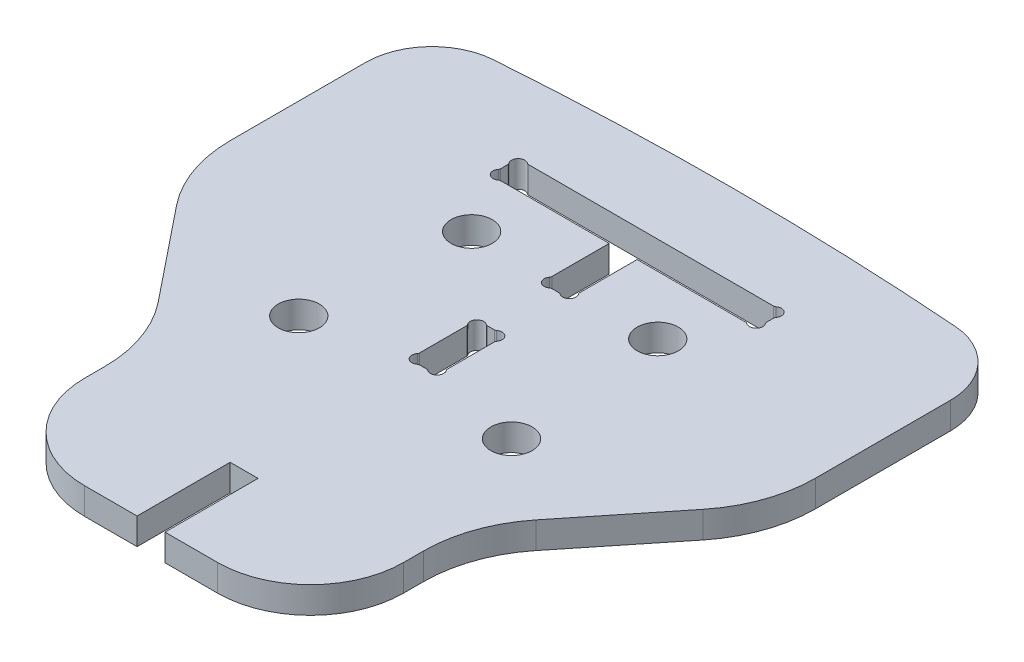
from build123d import *

# Parameters (mm, degrees)
EXTRUDE_1_DEPTH     = 2
SKETCH_2_W          = 1.05
SKETCH_2_H          = 5.1
CUT_EXTRUDE_1_DEPTH = 343.513123836
CUT_EXTRUDE_2_DEPTH = 343.513123836
FILLET_1_R          = 0.2
SKETCH_4_R          = 1.55
CUT_EXTRUDE_3_DEPTH = 343.513123836
FILLET_2_R          = 5
EXTRUDE_START       = -2
EXTRUDE_2_DEPTH     = 2
CUT_EXTRUDE_START   = -10
CUT_EXTRUDE_5_DEPTH = 10
SKETCH_6_W          = 2.1
SKETCH_6_H          = 7
CUT_EXTRUDE_4_DEPTH = 2
FILLET_8_R          = 7
FILLET_5_R          = 10
FILLET_6_R          = 10


with BuildPart() as part:
    # 草图1 → 凸台-拉伸1 (new body)
    with BuildSketch(Plane(origin=(0, 0, 0), x_dir=(1, 0, 0), z_dir=(0, 1, 0))):
        with BuildLine():
            Line((-22, 322.5), (-17, 320.227272727))
            Line((-17, 320.227272727), (-17, 312.037257391))
            ThreePointArc((-17, 312.037257391), (0, 312.5), (17, 312.037257391))
            Line((17, 312.037257391), (17, 320.227272727))
            Line((17, 320.227272727), (22, 322.5))
            Line((22, 322.5), (22, 340.767946523))
            ThreePointArc((22, 340.767946523), (0, 341.8), (-22, 340.767946523))
            Line((-22, 340.767946523), (-22, 322.5))
        make_face()
    extrude(amount=EXTRUDE_1_DEPTH)

    # 草图2 → 切除-拉伸1 (cut, through all)
    with BuildSketch(Plane(origin=(0, 2, 0), x_dir=(1, 0, 0), z_dir=(0, 1, 0))):
        Polygon((0, 335.65), (0, 328.45), (1.05, 328.45), (1.05, 333.55), (10, 333.55), (10, 335.65), align=None)
        Polygon((-1.05, 328.45), (0, 328.45), (0, 335.65), (-10, 335.65), (-10, 333.55), (-1.05, 333.55), align=None)
        with Locations((0.525, 321.05)):
            Rectangle(SKETCH_2_W, SKETCH_2_H)
        with Locations((-0.525, 321.05)):
            Rectangle(SKETCH_2_W, SKETCH_2_H)
    extrude(amount=-CUT_EXTRUDE_1_DEPTH, mode=Mode.SUBTRACT)

    # 草图3 → 切除-拉伸2 (cut, through all)
    with BuildSketch(Plane(origin=(0, 2, 0), x_dir=(1, 0, 0), z_dir=(0, 1, 0))):
        with BuildLine():
            Line((10, 335.65), (10, 334.942893219))
            ThreePointArc((10, 334.942893219), (10.108386376, 335.105104893), (10.146446609, 335.296446609))
            ThreePointArc((10.146446609, 335.296446609), (10.108386376, 335.487788326), (10, 335.65))
        make_face()
        with BuildLine():
            ThreePointArc((10, 335.65), (9.646446609, 335.796446609), (9.292893219, 335.65))
            Line((9.292893219, 335.65), (10, 335.65))
        make_face()
        with BuildLine():
            ThreePointArc((10.146446609, 333.903553391), (10.108386376, 334.094895107), (10, 334.257106781))
            Line((10, 334.257106781), (10, 333.55))
            ThreePointArc((10, 333.55), (10.108386376, 333.712211674), (10.146446609, 333.903553391))
        make_face()
        with BuildLine():
            Line((10, 333.55), (9.292893219, 333.55))
            ThreePointArc((9.292893219, 333.55), (9.646446609, 333.403553391), (10, 333.55))
        make_face()
        with BuildLine():
            ThreePointArc((1.196446609, 328.803553391), (1.158386376, 328.994895107), (1.05, 329.157106781))
            Line((1.05, 329.157106781), (1.05, 328.45))
            ThreePointArc((1.05, 328.45), (1.158386376, 328.612211674), (1.196446609, 328.803553391))
        make_face()
        with BuildLine():
            Line((1.05, 328.45), (0.342893219, 328.45))
            ThreePointArc((0.342893219, 328.45), (0.696446609, 328.303553391), (1.05, 328.45))
        make_face()
        with BuildLine():
            ThreePointArc((1.196446609, 323.246446609), (1.158386376, 323.437788326), (1.05, 323.6))
            Line((1.05, 323.6), (1.05, 322.892893219))
            ThreePointArc((1.05, 322.892893219), (1.158386376, 323.055104893), (1.196446609, 323.246446609))
        make_face()
        with BuildLine():
            ThreePointArc((1.05, 323.6), (0.696446609, 323.746446609), (0.342893219, 323.6))
            Line((0.342893219, 323.6), (1.05, 323.6))
        make_face()
        with BuildLine():
            ThreePointArc((1.196446609, 318.853553391), (1.158386376, 319.044895107), (1.05, 319.207106781))
            Line((1.05, 319.207106781), (1.05, 318.5))
            ThreePointArc((1.05, 318.5), (1.158386376, 318.662211674), (1.196446609, 318.853553391))
        make_face()
        with BuildLine():
            Line((1.05, 318.5), (0.342893219, 318.5))
            ThreePointArc((0.342893219, 318.5), (0.696446609, 318.353553391), (1.05, 318.5))
        make_face()
    cut_extrude_2 = extrude(amount=-CUT_EXTRUDE_2_DEPTH, mode=Mode.SUBTRACT)

    # 镜向1: 切除-拉伸2 across plane
    add(cut_extrude_2.mirror(Plane(origin=(0, 0, 0), x_dir=(0, 0, 1), z_dir=(1, 0, 0))), mode=Mode.SUBTRACT)

    # 圆角1
    fillet_1_edges = [part.edges().sort_by_distance(p)[0] for p in [
        (1.05, 1, -329.157106781),
        (0.342893219, 1, -323.6),
        (1.05, 1, -319.207106781),
        (9.292893219, 1, -335.65),
        (10, 1, -334.257106781),
        (0.342893219, 1, -328.45),
        (1.05, 1, -322.892893219),
        (0.342893219, 1, -318.5),
        (-10, 1, -334.942893219),
        (-9.292893219, 1, -333.55),
        (-1.05, 1, -329.157106781),
        (-0.342893219, 1, -323.6),
        (-1.05, 1, -319.207106781),
        (-9.292893219, 1, -335.65),
        (-10, 1, -334.257106781),
        (-0.342893219, 1, -328.45),
        (-1.05, 1, -322.892893219),
        (-0.342893219, 1, -318.5),
        (10, 1, -334.942893219),
        (9.292893219, 1, -333.55),
    ]]
    fillet(fillet_1_edges, radius=FILLET_1_R)

    # 草图4 → 切除-拉伸3 (cut, through all)
    with BuildSketch(Plane(origin=(0, 2, 0), x_dir=(1, 0, 0), z_dir=(0, 1, 0))):
        with Locations(Location((7, 329.15, 0), (0, 0, 270))):
            Circle(SKETCH_4_R)
        with Locations(Location((8, 317.15, 0), (0, 0, 270))):
            Circle(SKETCH_4_R)
    cut_extrude_3 = extrude(amount=-CUT_EXTRUDE_3_DEPTH, mode=Mode.SUBTRACT)

    # 镜向2: 切除-拉伸3 across plane
    add(cut_extrude_3.mirror(Plane(origin=(0, 0, 0), x_dir=(0, 0, 1), z_dir=(1, 0, 0))), mode=Mode.SUBTRACT)

    # 圆角2
    fillet_2_edges = [part.edges().sort_by_distance(p)[0] for p in [
        (-22, 1, -340.767946523),
        (22, 1, -340.767946523),
    ]]
    fillet(fillet_2_edges, radius=FILLET_2_R)

    # 草图5 → 凸台-拉伸2 (add)
    with BuildSketch(Plane(origin=(0, 2, 0), x_dir=(1, 0, 0), z_dir=(0, 1, 0)).offset(EXTRUDE_START)):
        with BuildLine():
            Line((-13.733814581, 312.198065877), (-12, 310.037257391))
            Line((-12, 310.037257391), (-12, 298.037257391))
            Line((-12, 298.037257391), (12, 298.037257391))
            Line((12, 298.037257391), (12, 310.037257391))
            Line((12, 310.037257391), (13.733814581, 312.198065877))
            ThreePointArc((13.733814581, 312.198065877), (0, 312.5), (-13.733814581, 312.198065877))
        make_face()
        Polygon((-22, 322.5), (-17, 316.268628695), (-17, 320.227272727), align=None)
        Polygon((17, 316.268628695), (22, 322.5), (17, 320.227272727), align=None)
    extrude(amount=EXTRUDE_2_DEPTH)

    # 草图5<3> → 切除-拉伸5 (cut)
    with BuildSketch(Plane(origin=(0, 2, 0), x_dir=(1, 0, 0), z_dir=(0, 1, 0)).offset(CUT_EXTRUDE_START)):
        with BuildLine():
            Line((-17, 310.037257391), (-17, 312.037257391))
            ThreePointArc((-17, 312.037257391), (-15.367117639, 312.121934019), (-13.733814581, 312.198065877))
            Line((-13.733814581, 312.198065877), (-22, 322.5))
            Line((-22, 322.5), (-22, 310.037257391))
            Line((-22, 310.037257391), (-17, 310.037257391))
        make_face()
        with BuildLine():
            ThreePointArc((-13.733814581, 312.198065877), (-15.367117639, 312.121934019), (-17, 312.037257391))
            Line((-17, 312.037257391), (-17, 310.037257391))
            Line((-17, 310.037257391), (-12, 310.037257391))
            Line((-12, 310.037257391), (-13.733814581, 312.198065877))
        make_face()
        with BuildLine():
            Line((22, 322.5), (13.733814581, 312.198065877))
            ThreePointArc((13.733814581, 312.198065877), (15.367117639, 312.121934019), (17, 312.037257391))
            Line((17, 312.037257391), (17, 310.037257391))
            Line((17, 310.037257391), (22, 310.037257391))
            Line((22, 310.037257391), (22, 322.5))
        make_face()
        with BuildLine():
            Line((13.733814581, 312.198065877), (12, 310.037257391))
            Line((12, 310.037257391), (17, 310.037257391))
            Line((17, 310.037257391), (17, 312.037257391))
            ThreePointArc((17, 312.037257391), (15.367117639, 312.121934019), (13.733814581, 312.198065877))
        make_face()
    extrude(amount=CUT_EXTRUDE_5_DEPTH, mode=Mode.SUBTRACT)

    # 草图6 → 切除-拉伸4 (cut)
    with BuildSketch(Plane(origin=(0, 2, 0), x_dir=(1, 0, 0), z_dir=(0, 1, 0))):
        with Locations((0, 301.537257391)):
            Rectangle(SKETCH_6_W, SKETCH_6_H)
    extrude(amount=-CUT_EXTRUDE_4_DEPTH, mode=Mode.SUBTRACT)

    # 圆角8
    fillet_8_edges = [part.edges().sort_by_distance(p)[0] for p in [
        (12, 1, -298.037257391),
        (-12, 1, -298.037257391),
    ]]
    fillet(fillet_8_edges, radius=FILLET_8_R)

    # 圆角5
    fillet_5_edges = [part.edges().sort_by_distance(p)[0] for p in [
        (22, 1, -322.5),
        (-22, 1, -322.5),
    ]]
    fillet(fillet_5_edges, radius=FILLET_5_R)

    # 圆角6
    fillet_6_edges = [part.edges().sort_by_distance(p)[0] for p in [
        (12, 1, -310.037257391),
        (-12, 1, -310.037257391),
    ]]
    fillet(fillet_6_edges, radius=FILLET_6_R)


solid = part.part
